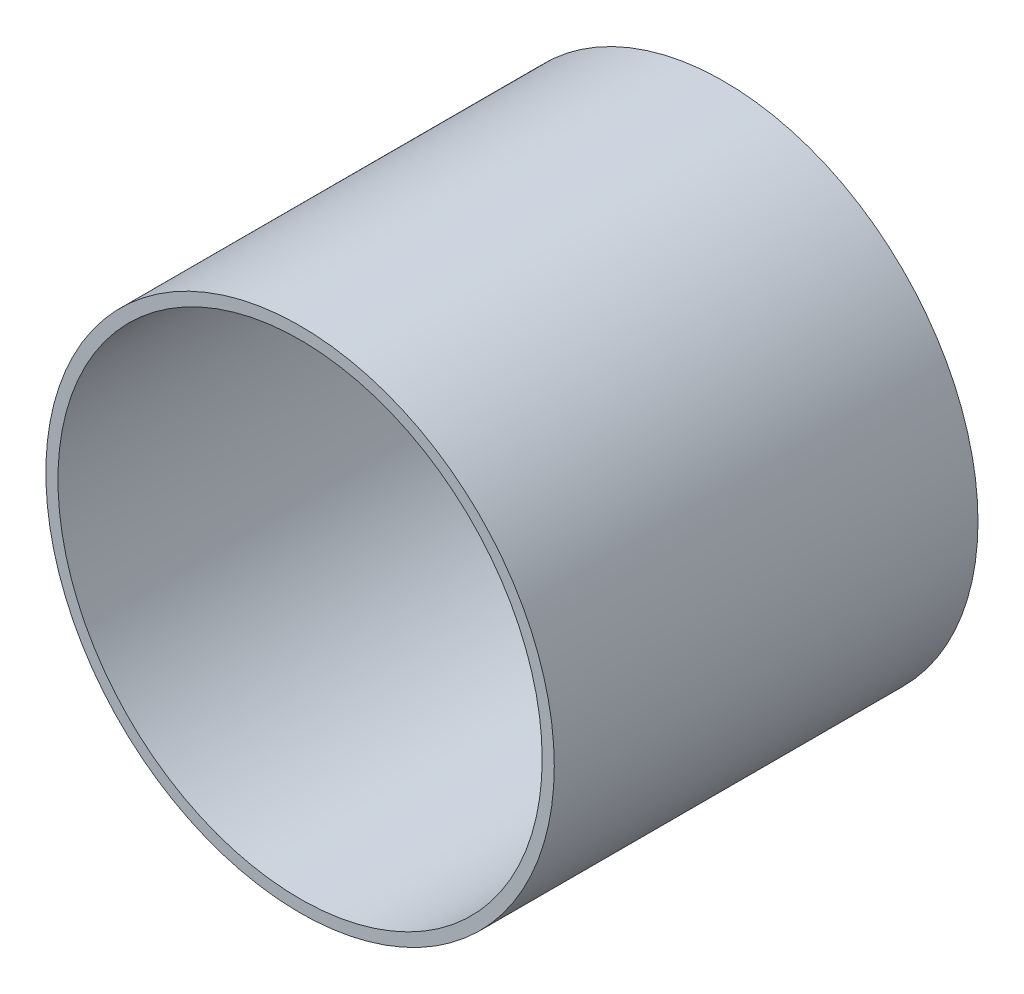
from build123d import *

# Parameters (mm, degrees)
EXTRUDE_START        = 200
EXTRUDE_SKETCH_1_R   = 16.8
EXTRUDE_SKETCH_1_R_2 = 16
EXTRUDE_1_DEPTH      = 28


with BuildPart() as part:
    # Extrude sketch 1 → Extrude 1 (new body)
    with BuildSketch(Plane.XY.offset(EXTRUDE_START)):
        Circle(EXTRUDE_SKETCH_1_R)
        Circle(EXTRUDE_SKETCH_1_R_2, mode=Mode.SUBTRACT)
    extrude(amount=EXTRUDE_1_DEPTH)


solid = part.part
